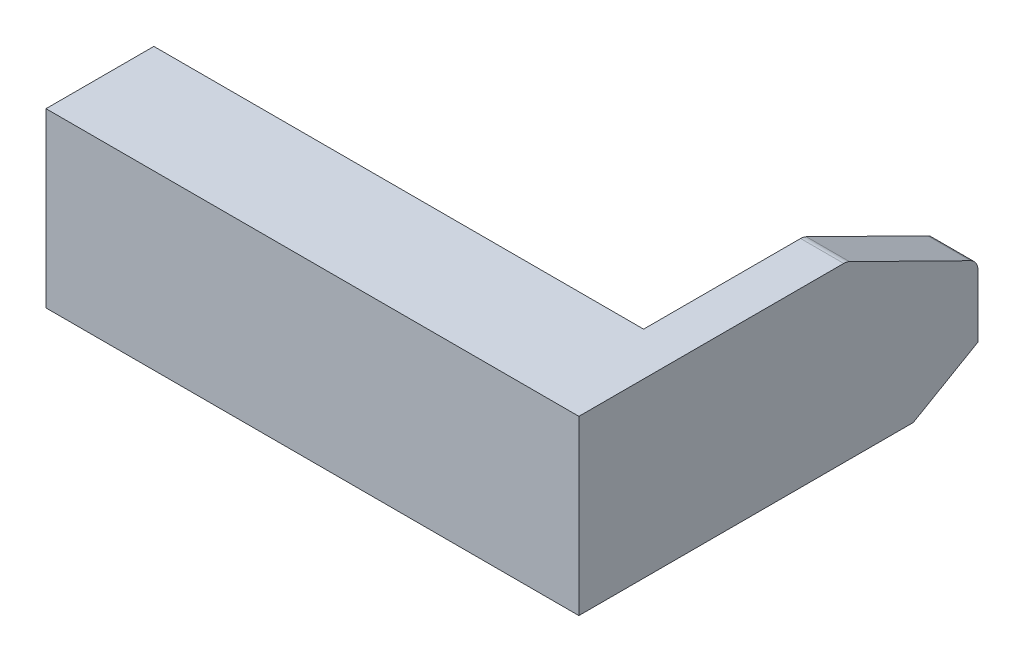
from build123d import *

# Parameters (mm, degrees)
SKETCH1_W           = 92.5
SKETCH1_H           = 40
BOSS_EXTRUDE1_DEPTH = 10
SKETCH5_R           = 5.5
CUT_EXTRUDE1_DEPTH  = 8.5
SKETCH4_W           = 25
SKETCH4_H           = 40
SKETCH4_W_2         = 10.25
SKETCH4_H_2         = 25.25
BOSS_EXTRUDE7_DEPTH = 113.5
FILLET1_R           = 3
CHAMFER1_SIZE       = 15
CHAMFER1_SIZE2      = 30.41699103
FILLET3_R           = 3
CHAMFER3_SIZE       = 15
CHAMFER3_SIZE2      = 8.660254038


with BuildPart() as part:
    # Sketch1 → Boss-Extrude1 (new body)
    with BuildSketch(Plane(origin=(0, 0, 0), x_dir=(0, 0, -1), z_dir=(1, 0, 0))):
        with Locations((10.335365854, 0.129573171)):
            Rectangle(SKETCH1_W, SKETCH1_H)
    extrude(amount=BOSS_EXTRUDE1_DEPTH)

    # Sketch5 → Cut-Extrude1 (cut)
    with BuildSketch(Plane.ZY):
        with Locations((-35.585365854, 0.129573171)):
            Circle(SKETCH5_R)
    extrude(amount=-CUT_EXTRUDE1_DEPTH, mode=Mode.SUBTRACT)

    # Sketch4 → Boss-Extrude7 (add)
    with BuildSketch(Plane.ZY):
        with Locations((23.414634146, 0.129573171)):
            Rectangle(SKETCH4_W, SKETCH4_H)
        with Locations((23.414634146, 0.129573171)):
            Rectangle(SKETCH4_W_2, SKETCH4_H_2, mode=Mode.SUBTRACT)
    extrude(amount=BOSS_EXTRUDE7_DEPTH)

    # Fillet1
    fillet1_edges = [part.edges().sort_by_distance(p)[0] for p in [
        (-113.5, 12.754573171, 23.414634146),
        (-113.5, 0.129573171, 18.289634146),
        (-113.5, -12.495426829, 23.414634146),
        (-113.5, 0.129573171, 28.539634146),
    ]]
    fillet(fillet1_edges, radius=FILLET1_R)

    # Chamfer1
    chamfer1_edges = [part.edges().sort_by_distance(p)[0] for p in [
        (5, 20.129573171, -56.585365854),
    ]]
    chamfer1_side = [part.faces().sort_by_distance(p)[0] for p in [
        (5, 0.129573171, -56.585365854),
    ]]
    chamfer(chamfer1_edges, length=CHAMFER1_SIZE, length2=CHAMFER1_SIZE2, reference=chamfer1_side[0])

    # Fillet3
    fillet3_edges = [part.edges().sort_by_distance(p)[0] for p in [
        (5, 20.129573171, -26.168374824),
        (5, 5.129573171, -56.585365854),
    ]]
    fillet(fillet3_edges, radius=FILLET3_R)

    # Chamfer3
    chamfer3_edges = [part.edges().sort_by_distance(p)[0] for p in [
        (5, -19.870426829, -56.585365854),
    ]]
    chamfer3_side = [part.faces().sort_by_distance(p)[0] for p in [
        (-41.568936877, -19.870426829, 15.117291954),
    ]]
    chamfer(chamfer3_edges, length=CHAMFER3_SIZE, length2=CHAMFER3_SIZE2, reference=chamfer3_side[0])


solid = part.part
